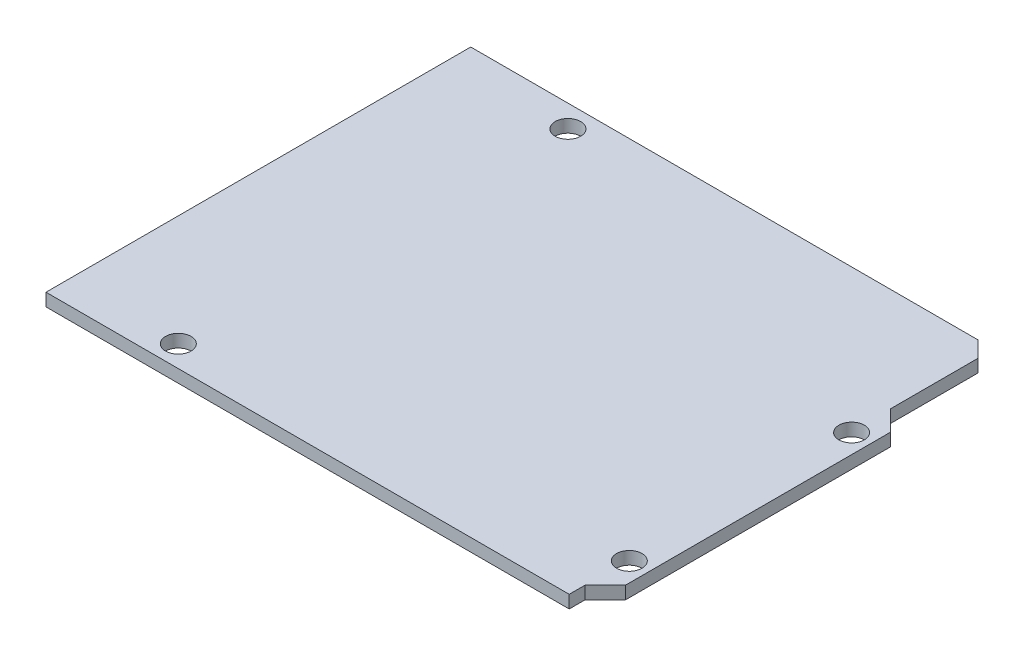
from build123d import *

# Parameters (mm, degrees)
BOSS_EXTRUDE1_DEPTH = 1.6
SKETCH4_R           = 1.6
CUT_EXTRUDE1_DEPTH  = 1.6


with BuildPart() as part:
    # Sketch3 → Boss-Extrude1 (new body)
    with BuildSketch(Plane(origin=(0, 0, 0), x_dir=(1, 0, 0), z_dir=(0, 1, 0))):
        Polygon((-34.1, 26.65), (29.56, 26.65), (31.56, 24.65), (31.56, 13.7), (34.1, 11.16), (34.1, -22.11), (31.56, -24.65), (31.56, -26.65), (-34.1, -26.65), align=None)
    extrude(amount=BOSS_EXTRUDE1_DEPTH)

    # Sketch4 → Cut-Extrude1 (cut)
    with BuildSketch(Plane(origin=(0, 1.6, 0), x_dir=(1, 0, 0), z_dir=(0, 1, 0))):
        with Locations(Location((-19.1, 23.85, 0), (0, 0, 270))):
            Circle(SKETCH4_R)
        with Locations(Location((31.7, 8.65, 0), (0, 0, 270))):
            Circle(SKETCH4_R)
        with Locations(Location((31.7, -19.25, 0), (0, 0, 270))):
            Circle(SKETCH4_R)
        with Locations(Location((-20.2, -23.95, 0), (0, 0, 270))):
            Circle(SKETCH4_R)
    extrude(amount=-CUT_EXTRUDE1_DEPTH, mode=Mode.SUBTRACT)


solid = part.part
